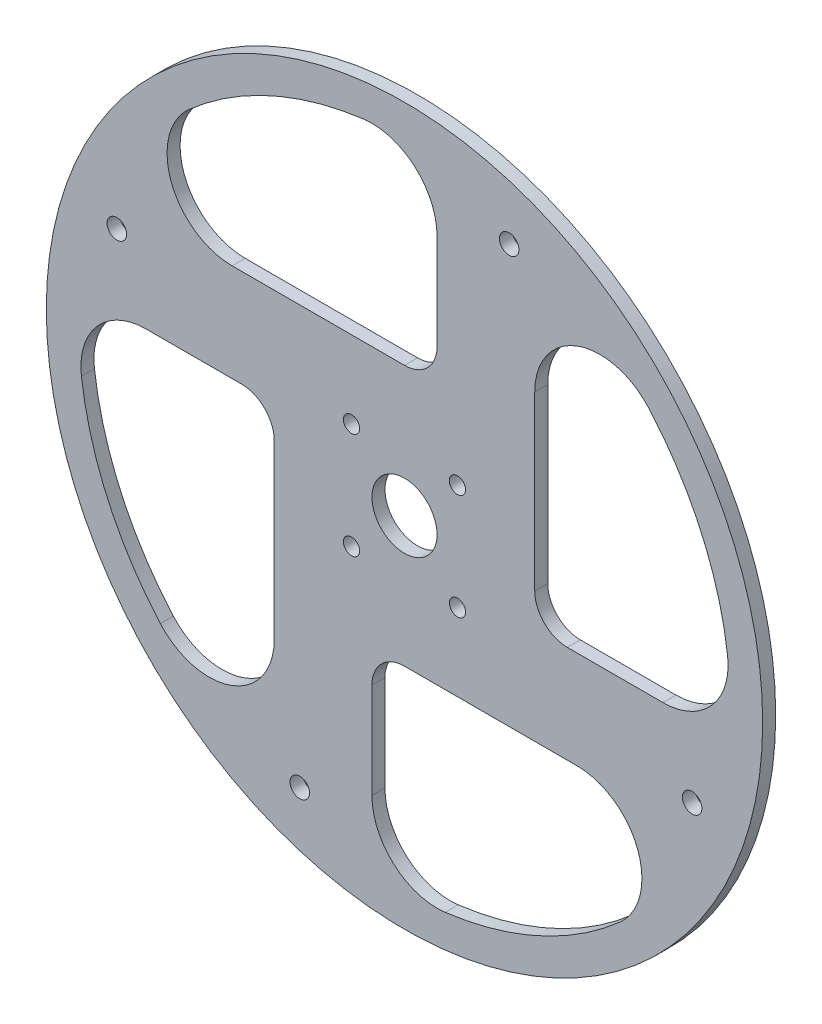
from build123d import *

# Parameters (mm, degrees)
SKETCH_1_R      = 55
SKETCH_1_R_2    = 1.5
SKETCH_1_R_3    = 1.25
SKETCH_1_R_4    = 5
EXTRUDE_1_DEPTH = 2


with BuildPart() as part:
    # 草图1 → 凸台-拉伸1 (new body)
    with BuildSketch(Plane.XY):
        Circle(SKETCH_1_R)
        with Locations((-16.074946736, -44.165553177)):
            Circle(SKETCH_1_R_2, mode=Mode.SUBTRACT)
        with BuildLine():
            Line((-39.686269666, 5), (-25, 5))
            ThreePointArc((-25, 5), (-21.464466094, 3.535533906), (-20, 0))
            Line((-20, 0), (-20, -26.457513111))
            ThreePointArc((-20, -26.457513111), (-26.464466094, -35.811656578), (-37.5, -33.071891388))
            ThreePointArc((-37.5, -33.071891388), (-45.571891388, -20.571891388), (-49.607837082, -6.25))
            ThreePointArc((-49.607837082, -6.25), (-47.186269666, 1.614378278), (-39.686269666, 5))
        make_face(mode=Mode.SUBTRACT)
        with Locations((-8.131727984, -8.131727984)):
            Circle(SKETCH_1_R_3, mode=Mode.SUBTRACT)
        with BuildLine():
            ThreePointArc((-5, -25), (-3.535533906, -21.464466094), (0, -20))
            Line((0, -20), (26.457513111, -20))
            ThreePointArc((26.457513111, -20), (35.811656578, -26.464466094), (33.071891388, -37.5))
            ThreePointArc((33.071891388, -37.5), (20.571891388, -45.571891388), (6.25, -49.607837082))
            ThreePointArc((6.25, -49.607837082), (-1.614378278, -47.186269666), (-5, -39.686269666))
            Line((-5, -39.686269666), (-5, -25))
        make_face(mode=Mode.SUBTRACT)
        with Locations((8.131727984, -8.131727984)):
            Circle(SKETCH_1_R_3, mode=Mode.SUBTRACT)
        with Locations((44.165553177, -16.074946736)):
            Circle(SKETCH_1_R_2, mode=Mode.SUBTRACT)
        with Locations((-44.165553177, 16.074946736)):
            Circle(SKETCH_1_R_2, mode=Mode.SUBTRACT)
        with Locations((-8.131727984, 8.131727984)):
            Circle(SKETCH_1_R_3, mode=Mode.SUBTRACT)
        with BuildLine():
            ThreePointArc((5, 25), (3.535533906, 21.464466094), (0, 20))
            Line((0, 20), (-26.457513111, 20))
            ThreePointArc((-26.457513111, 20), (-35.811656578, 26.464466094), (-33.071891388, 37.5))
            ThreePointArc((-33.071891388, 37.5), (-20.571891388, 45.571891388), (-6.25, 49.607837082))
            ThreePointArc((-6.25, 49.607837082), (1.614378278, 47.186269666), (5, 39.686269666))
            Line((5, 39.686269666), (5, 25))
        make_face(mode=Mode.SUBTRACT)
        Circle(SKETCH_1_R_4, mode=Mode.SUBTRACT)
        with Locations((8.131727984, 8.131727984)):
            Circle(SKETCH_1_R_3, mode=Mode.SUBTRACT)
        with BuildLine():
            ThreePointArc((25, -5), (21.464466094, -3.535533906), (20, 0))
            Line((20, 0), (20, 26.457513111))
            ThreePointArc((20, 26.457513111), (26.464466094, 35.811656578), (37.5, 33.071891388))
            ThreePointArc((37.5, 33.071891388), (45.571891388, 20.571891388), (49.607837082, 6.25))
            ThreePointArc((49.607837082, 6.25), (47.186269666, -1.614378278), (39.686269666, -5))
            Line((39.686269666, -5), (25, -5))
        make_face(mode=Mode.SUBTRACT)
        with Locations((16.074946736, 44.165553177)):
            Circle(SKETCH_1_R_2, mode=Mode.SUBTRACT)
    extrude(amount=EXTRUDE_1_DEPTH)


solid = part.part
